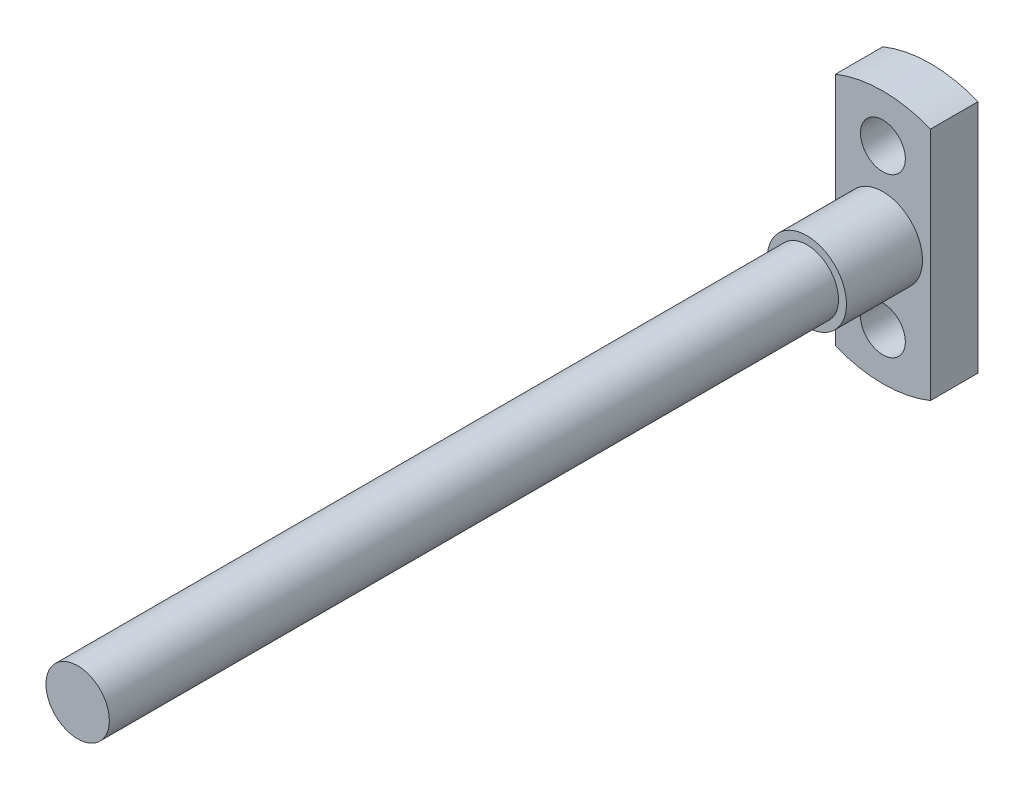
from build123d import *

# Parameters (mm, degrees)
BOSS_EXTRUDE1_DEPTH         = 4.7625
SKETCH2_R                   = 3.96875
BOSS_EXTRUDE2_DEPTH         = 7.62
SKETCH3_R                   = 3.175
BOSS_EXTRUDE3_DEPTH         = 73.025
F_16_0_177_DIAMETER_HOLE1_D = 4.4958


with BuildPart() as part:
    # Sketch1 → Boss-Extrude1 (new body)
    with BuildSketch(Plane.XY):
        with BuildLine():
            Line((0, 0), (0, 23.546430197))
            ThreePointArc((0, 23.546430197), (4.7625, 24.473215098), (9.525, 23.546430197))
            Line((9.525, 23.546430197), (9.525, 0))
            ThreePointArc((9.525, 0), (4.7625, -0.926784902), (0, 0))
        make_face()
    extrude(amount=BOSS_EXTRUDE1_DEPTH)

    # Sketch2 → Boss-Extrude2 (add)
    with BuildSketch(Plane.XY.offset(4.7625)):
        with Locations(Location((4.7625, 11.773215098, 0), (0, 0, 180))):
            Circle(SKETCH2_R)
    extrude(amount=BOSS_EXTRUDE2_DEPTH)

    # Sketch3 → Boss-Extrude3 (add)
    with BuildSketch(Plane.XY.offset(12.3825)):
        with Locations((4.7625, 11.773215098)):
            Circle(SKETCH3_R)
    extrude(amount=BOSS_EXTRUDE3_DEPTH)

    # #16 (0.177) Diameter Hole1 (through all)
    with Locations(Plane.XY.offset(4.7625)):
        with Locations((4.7625, 3.835715098), (4.7625, 19.710715098)):
            Hole(F_16_0_177_DIAMETER_HOLE1_D / 2)


solid = part.part
